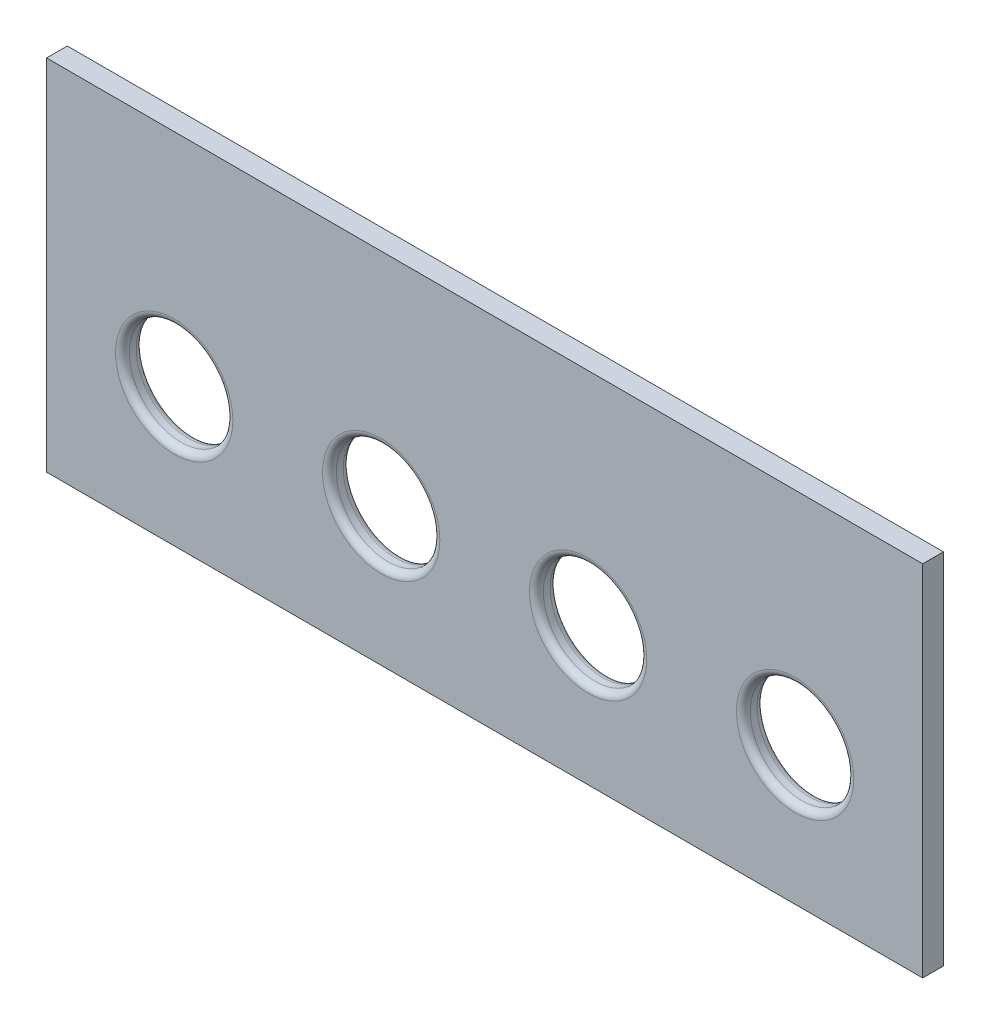
from build123d import *

# Parameters (mm, degrees)
SKETCH_1_W          = 127
SKETCH_1_H          = 52
EXTRUDE_1_DEPTH     = 3
SKETCH_2_R          = 7.5
CUT_EXTRUDE_1_DEPTH = 3
FILLET_1_R          = 1


with BuildPart() as part:
    # 草图1 → 凸台-拉伸1 (new body)
    with BuildSketch(Plane.XY):
        with Locations((63.5, -26)):
            Rectangle(SKETCH_1_W, SKETCH_1_H)
    extrude(amount=EXTRUDE_1_DEPTH)

    # 草图2 → 切除-拉伸1 (cut)
    with BuildSketch(Plane.XY.offset(3)):
        with Locations((78.5, -32)):
            Circle(SKETCH_2_R)
        with Locations((108.5, -32)):
            Circle(SKETCH_2_R)
        with Locations((48.5, -32)):
            Circle(SKETCH_2_R)
        with Locations((18.5, -32)):
            Circle(SKETCH_2_R)
    extrude(amount=-CUT_EXTRUDE_1_DEPTH, mode=Mode.SUBTRACT)

    # 圆角1
    fillet_1_edges = [part.edges().sort_by_distance(p)[0] for p in [
        (11, -32, 0),
        (11, -32, 3),
        (41, -32, 0),
        (41, -32, 3),
        (101, -32, 0),
        (101, -32, 3),
        (71, -32, 0),
        (71, -32, 3),
    ]]
    fillet(fillet_1_edges, radius=FILLET_1_R)


solid = part.part
